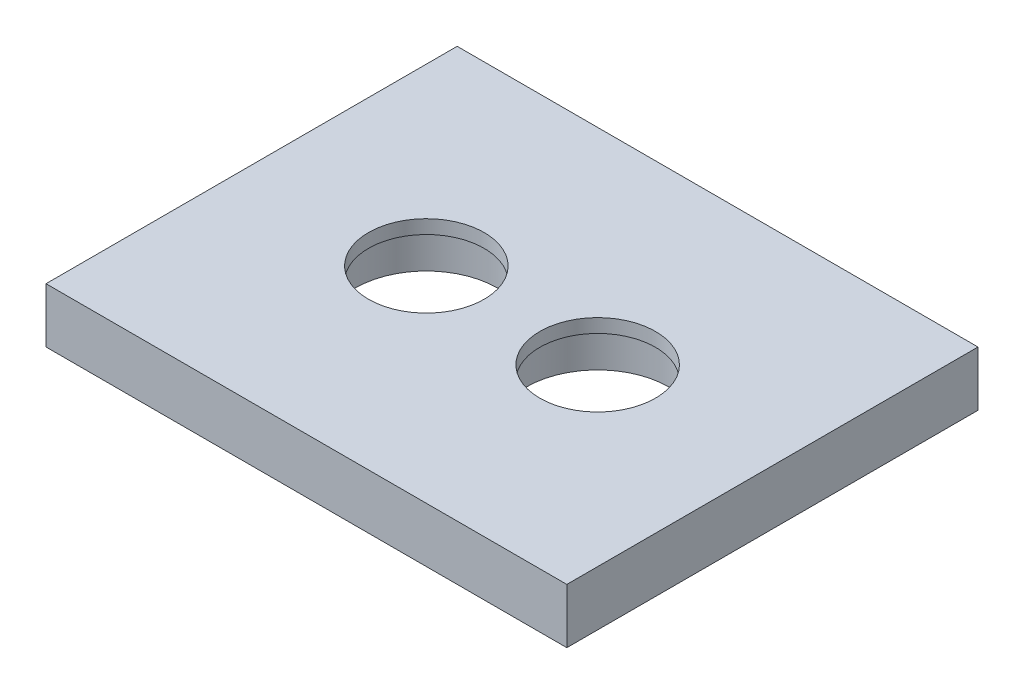
from build123d import *

# Parameters (mm, degrees)
SKETCH1_W           = 190
SKETCH1_H           = 150
BOSS_EXTRUDE1_DEPTH = 20
CUT_EXTRUDE1_REACH  = 124.678
SKETCH2_R           = 26
SKETCH9_R           = 26
SKETCH9_R_2         = 21.1
BOSS_EXTRUDE2_DEPTH = 5


with BuildPart() as part:
    # Sketch1 → Boss-Extrude1 (new body)
    with BuildSketch(Plane(origin=(0, 0, 0), x_dir=(1, 0, 0), z_dir=(0, 1, 0))):
        Rectangle(SKETCH1_W, SKETCH1_H)
    extrude(amount=BOSS_EXTRUDE1_DEPTH)

    # Sketch2 → Cut-Extrude1 (cut, up to next)
    with BuildSketch(Plane(origin=(0, 20, 0), x_dir=(1, 0, 0), z_dir=(0, 1, 0)), mode=Mode.PRIVATE) as cut_extrude1_sk1:
        with Locations(Location((31.25, 0, 0), (0, 0, 270))):
            Circle(SKETCH2_R)
    cut_extrude1_tool1 = extrude(cut_extrude1_sk1.sketch, amount=-CUT_EXTRUDE1_REACH, mode=Mode.PRIVATE) & part.part
    # Sketch2 → Cut-Extrude1 (cut, up to next)
    with BuildSketch(Plane(origin=(0, 20, 0), x_dir=(1, 0, 0), z_dir=(0, 1, 0)), mode=Mode.PRIVATE) as cut_extrude1_sk2:
        with Locations(Location((-31.25, 0, 0), (0, 0, 270))):
            Circle(SKETCH2_R)
    cut_extrude1_tool2 = extrude(cut_extrude1_sk2.sketch, amount=-CUT_EXTRUDE1_REACH, mode=Mode.PRIVATE) & part.part
    add(cut_extrude1_tool1.solids().sort_by_distance((31.25, 20, 0))[0], mode=Mode.SUBTRACT)
    add(cut_extrude1_tool2.solids().sort_by_distance((-31.25, 20, 0))[0], mode=Mode.SUBTRACT)

    # Sketch9 → Boss-Extrude2 (add)
    # profile 1 of 2: a face of its own
    with BuildSketch(Plane(origin=(0, 20, 0), x_dir=(1, 0, 0), z_dir=(0, 1, 0))):
        with Locations(Location((-31.25, 0, 0), (0, 0, 270))):
            Circle(SKETCH9_R)
        with Locations(Location((-31.25, 0, 0), (0, 0, 270))):
            Circle(SKETCH9_R_2, mode=Mode.SUBTRACT)
    # profile 2 of 2: a face of its own
    with BuildSketch(Plane(origin=(0, 20, 0), x_dir=(1, 0, 0), z_dir=(0, 1, 0))):
        with Locations(Location((31.25, 0, 0), (0, 0, 270))):
            Circle(SKETCH9_R)
        with Locations(Location((31.25, 0, 0), (0, 0, 270))):
            Circle(SKETCH9_R_2, mode=Mode.SUBTRACT)
    extrude(amount=-BOSS_EXTRUDE2_DEPTH)


solid = part.part
